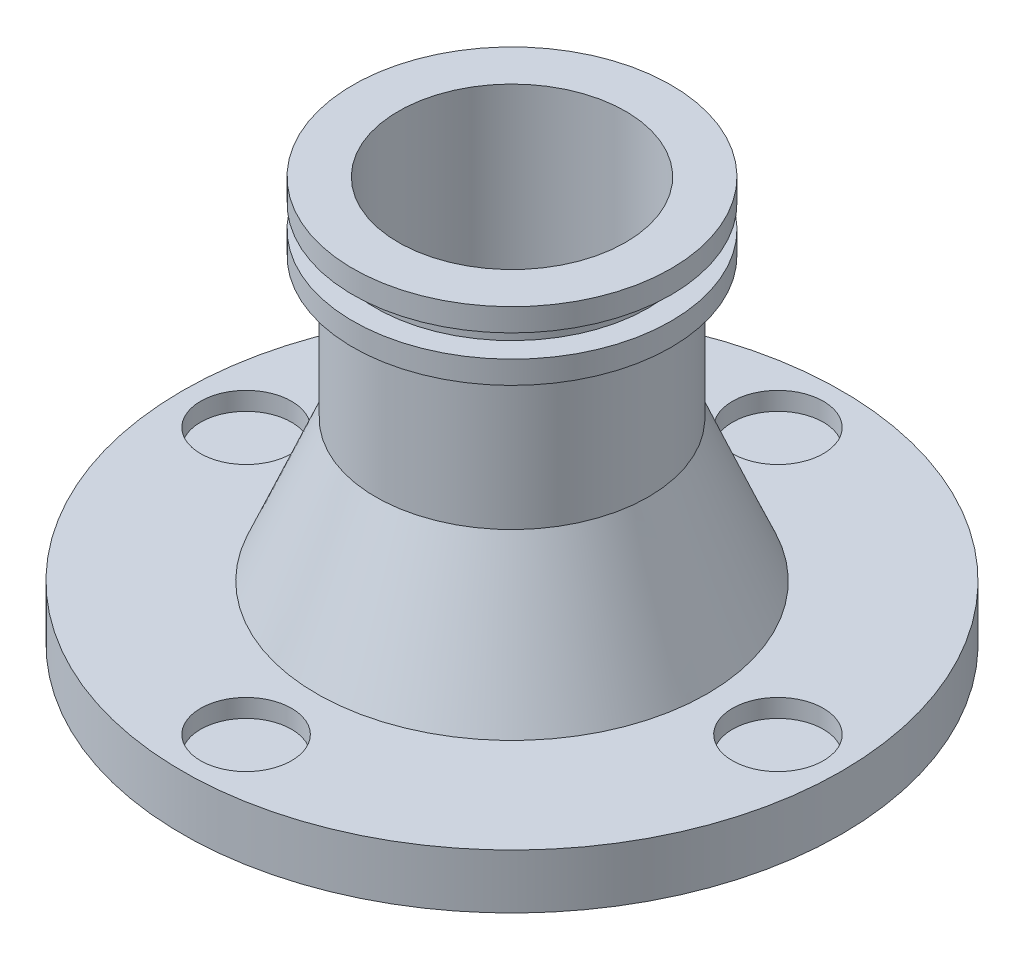
from build123d import *

# Parameters (mm, degrees)
SKETCH5_R          = 10
CUT_EXTRUDE1_DEPTH = 4


with BuildPart() as part:
    # Sketch1 → Revolve1 (revolve)
    with BuildSketch(Plane.XY, mode=Mode.PRIVATE) as revolve1_sk:
        Polygon((-25, 89), (-35, 89), (-35, 84), (-30, 84), (-30, 79), (-35, 79), (-35, 74), (-30, 74), (-30, 43), (-42.976744186, 12), (-72.5, 12), (-72.5, 0), (-43, 0), (-25, 43), align=None)
    revolve(revolve1_sk.sketch.rotate(Axis((0, 0, 0), (0, 1, 0)), 180), axis=Axis((0, 0, 0), (0, 1, 0)))

    # Sketch5 → Cut-Extrude1 (cut)
    with BuildSketch(Plane(origin=(0, 12, 0), x_dir=(1, 0, 0), z_dir=(0, 1, 0))):
        with Locations(Location((0, 58.5, 0), (0, 0, 180))):
            Circle(SKETCH5_R)
        with Locations(Location((58.5, 0, 0), (0, 0, 180))):
            Circle(SKETCH5_R)
        with Locations(Location((0, -58.5, 0), (0, 0, 180))):
            Circle(SKETCH5_R)
        with Locations(Location((-58.5, 0, 0), (0, 0, 180))):
            Circle(SKETCH5_R)
    extrude(amount=-CUT_EXTRUDE1_DEPTH, mode=Mode.SUBTRACT)


solid = part.part
